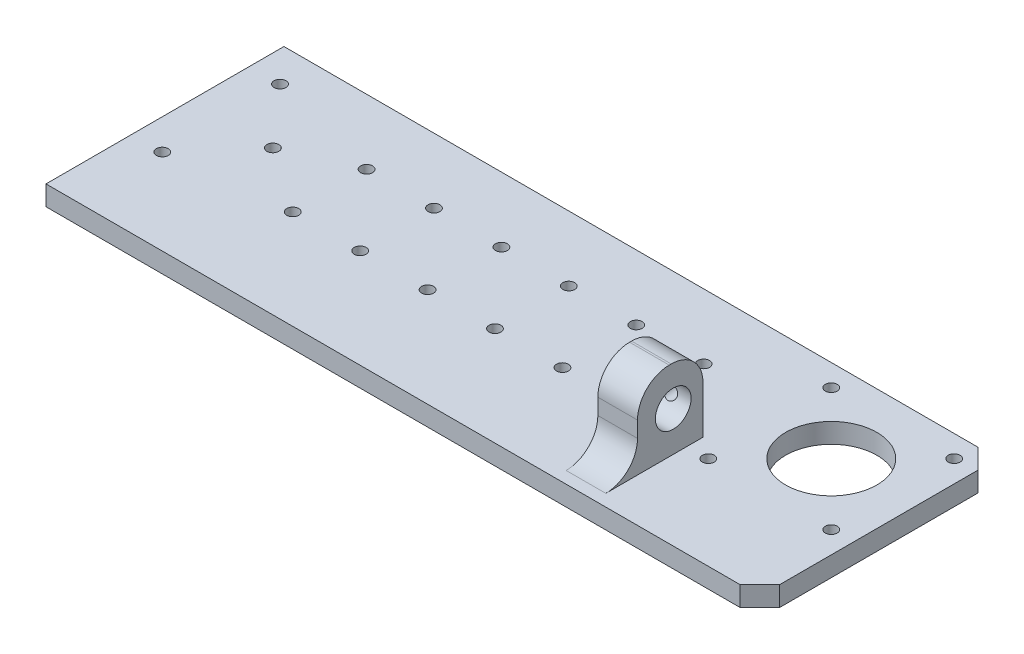
from build123d import *

# Parameters (mm, degrees)
SKETCH_1_W           = 180
SKETCH_1_H           = 60
SKETCH_1_R           = 11
SKETCH_1_R_2         = 1.5
EXTRUDE_3_DEPTH      = 5
SKETCH_2_W           = 10
SKETCH_2_H           = 20
EXTRUDE_4_DEPTH      = 20
SKETCH_4_R           = 4
CUT_EXTRUDE_1_DEPTH  = 20
SKETCH_8_W           = 3
SKETCH_8_H           = 20
CUT_EXTRUDE_4_DEPTH  = 10
SKETCH_10_W          = 14
SKETCH_10_H          = 20
EXTRUDE_5_DEPTH      = 10
SKETCH_9_R           = 4
CUT_EXTRUDE_5_DEPTH  = 10
SKETCH_12_W          = 13.5
SKETCH_12_H          = 20
CUT_EXTRUDE_6_DEPTH  = 10
SKETCH_15_W          = 1
SKETCH_15_H          = 20
CUT_EXTRUDE_7_DEPTH  = 10
FILLET_5_R           = 5
SKETCH_21_W          = 10
SKETCH_21_H          = 18
EXTRUDE_6_DEPTH      = 20
SKETCH_25_W          = 11.311173877
SKETCH_25_H          = 1.5
CUT_EXTRUDE_10_DEPTH = 20
SKETCH_37_W          = 10
SKETCH_37_H          = 20
EXTRUDE_9_DEPTH      = 6
SKETCH_38_W          = 10
SKETCH_38_H          = 20
CUT_EXTRUDE_12_DEPTH = 6
SKETCH_39_R          = 4
CUT_EXTRUDE_13_DEPTH = 144.937604561
FILLET_10_R          = 8
SKETCH_41_R          = 1.5
CUT_EXTRUDE_14_DEPTH = 10
SKETCH_42_R          = 11.5
CUT_EXTRUDE_15_DEPTH = 10
SKETCH_43_R          = 1.691985253
CUT_EXTRUDE_16_DEPTH = 10
SKETCH_44_R          = 4.5
CUT_EXTRUDE_17_DEPTH = 10
CUT_EXTRUDE_18_DEPTH = 10


with BuildPart() as part:
    # 스케치1 → 보스-돌출3 (new body)
    with BuildSketch(Plane(origin=(0, 0, 0), x_dir=(1, 0, 0), z_dir=(0, 1, 0))):
        with Locations((36.632340007, -1.742375967)):
            Rectangle(SKETCH_1_W, SKETCH_1_H)
        with Locations(Location((105.632340007, 7.257624033, 0), (0, 0, 270))):
            Circle(SKETCH_1_R, mode=Mode.SUBTRACT)
        with Locations(Location((90.132340007, 22.757624033, 0), (0, 0, 270))):
            Circle(SKETCH_1_R_2, mode=Mode.SUBTRACT)
        with Locations(Location((121.132340007, 22.757624033, 0), (0, 0, 270))):
            Circle(SKETCH_1_R_2, mode=Mode.SUBTRACT)
        with Locations(Location((90.132340007, -8.242375967, 0), (0, 0, 270))):
            Circle(SKETCH_1_R_2, mode=Mode.SUBTRACT)
        with Locations(Location((121.132340007, -8.242375967, 0), (0, 0, 270))):
            Circle(SKETCH_1_R_2, mode=Mode.SUBTRACT)
        with Locations(Location((-32.617755763, 4.712595626, 0), (0, 0, 270))):
            Circle(SKETCH_1_R_2, mode=Mode.SUBTRACT)
        with Locations(Location((-45.654401225, 19.548720133, 0), (0, 0, 270))):
            Circle(SKETCH_1_R_2, mode=Mode.SUBTRACT)
        with Locations(Location((-45.654401225, -10.123528882, 0), (0, 0, 270))):
            Circle(SKETCH_1_R_2, mode=Mode.SUBTRACT)
    extrude(amount=EXTRUDE_3_DEPTH)

    # 스케치2 → 보스-돌출4 (add)
    with BuildSketch(Plane(origin=(0, 5, 0), x_dir=(1, 0, 0), z_dir=(0, 1, 0))):
        with Locations((79.782459712, 8.257624033)):
            Rectangle(SKETCH_2_W, SKETCH_2_H)
    extrude(amount=EXTRUDE_4_DEPTH)

    # 스케치4 → 컷-돌출1 (cut)
    with BuildSketch(Plane.ZY.offset(-74.782459712)):
        with Locations((-8.257624033, 15)):
            Circle(SKETCH_4_R)
    extrude(amount=-CUT_EXTRUDE_1_DEPTH, mode=Mode.SUBTRACT)

    # 스케치8 → 컷-돌출4 (cut)
    with BuildSketch(Plane(origin=(84.782459712, 0, 0), x_dir=(0, 0, -1), z_dir=(1, 0, 0))):
        with Locations((16.757624033, 15)):
            Rectangle(SKETCH_8_W, SKETCH_8_H)
        with Locations((-0.242375967, 15)):
            Rectangle(SKETCH_8_W, SKETCH_8_H)
    extrude(amount=-CUT_EXTRUDE_4_DEPTH, mode=Mode.SUBTRACT)

    # 스케치10 → 보스-돌출5 (add)
    with BuildSketch(Plane(origin=(84.782459712, 0, 0), x_dir=(0, 0, -1), z_dir=(1, 0, 0))):
        with Locations((-5.242375967, 15)):
            Rectangle(SKETCH_10_W, SKETCH_10_H)
    extrude(amount=-EXTRUDE_5_DEPTH)

    # 스케치9 → 컷-돌출5 (cut)
    with BuildSketch(Plane(origin=(84.782459712, 0, 0), x_dir=(0, 0, -1), z_dir=(1, 0, 0))):
        with Locations((-5.242375967, 15)):
            Circle(SKETCH_9_R)
    extrude(amount=-CUT_EXTRUDE_5_DEPTH, mode=Mode.SUBTRACT)

    # 스케치12 → 컷-돌출6 (cut)
    with BuildSketch(Plane(origin=(84.782459712, 0, 0), x_dir=(0, 0, -1), z_dir=(1, 0, 0))):
        with Locations((8.507624033, 15)):
            Rectangle(SKETCH_12_W, SKETCH_12_H)
    extrude(amount=-CUT_EXTRUDE_6_DEPTH, mode=Mode.SUBTRACT)

    # 스케치15 → 컷-돌출7 (cut)
    with BuildSketch(Plane(origin=(84.782459712, 0, 0), x_dir=(0, 0, -1), z_dir=(1, 0, 0))):
        with Locations((1.257624033, 15)):
            Rectangle(SKETCH_15_W, SKETCH_15_H)
    extrude(amount=-CUT_EXTRUDE_7_DEPTH, mode=Mode.SUBTRACT)

    # 필렛5
    fillet_5_edges = [part.edges().sort_by_distance(p)[0] for p in [
        (79.782459712, 25, -0.757624033),
        (79.782459712, 25, 12.242375967),
    ]]
    fillet(fillet_5_edges, radius=FILLET_5_R)

    # 스케치21 → 보스-돌출6 (add)
    with BuildSketch(Plane(origin=(0, 5, 0), x_dir=(1, 0, 0), z_dir=(0, 1, 0))):
        with Locations((79.782459712, -5.742375967)):
            Rectangle(SKETCH_21_W, SKETCH_21_H)
    extrude(amount=EXTRUDE_6_DEPTH)

    # 스케치25 → 컷-돌출10 (cut)
    with BuildSketch(Plane(origin=(0, 5, 0), x_dir=(1, 0, 0), z_dir=(0, 1, 0))):
        with Locations((79.126872773, 2.507624033)):
            Rectangle(SKETCH_25_W, SKETCH_25_H)
    extrude(amount=CUT_EXTRUDE_10_DEPTH, mode=Mode.SUBTRACT)

    # 스케치37 → 보스-돌출9 (add)
    with BuildSketch(Plane.XY.offset(14.742375967)):
        with Locations((79.782459712, 15)):
            Rectangle(SKETCH_37_W, SKETCH_37_H)
    extrude(amount=EXTRUDE_9_DEPTH)

    # 스케치38 → 컷-돌출12 (cut)
    with BuildSketch(Plane(origin=(0, 0, -1.757624033), x_dir=(-1, 0, 0), z_dir=(0, 0, -1))):
        with Locations((-79.782459712, 15)):
            Rectangle(SKETCH_38_W, SKETCH_38_H)
    extrude(amount=-CUT_EXTRUDE_12_DEPTH, mode=Mode.SUBTRACT)

    # 스케치39 → 컷-돌출13 (cut, through all)
    with BuildSketch(Plane(origin=(84.782459712, 0, 0), x_dir=(0, 0, -1), z_dir=(1, 0, 0))):
        with Locations((-11.742375967, 15)):
            Circle(SKETCH_39_R)
    extrude(amount=-CUT_EXTRUDE_13_DEPTH, mode=Mode.SUBTRACT)

    # 필렛10
    fillet_10_edges = [part.edges().sort_by_distance(p)[0] for p in [
        (79.782459712, 25, 20.742375967),
        (79.782459712, 5, 20.742375967),
        (79.782459712, 25, 4.242375967),
    ]]
    fillet(fillet_10_edges, radius=FILLET_10_R)

    # 스케치41 → 컷-돌출14 (cut)
    with BuildSketch(Plane(origin=(0, 5, 0), x_dir=(1, 0, 0), z_dir=(0, 1, 0))):
        with Locations(Location((-16.145477704, -6.751246634, 0), (0, 0, 270))):
            Circle(SKETCH_41_R)
        with Locations(Location((-16.145477704, 11.864366715, 0), (0, 0, 270))):
            Circle(SKETCH_41_R)
        with Locations(Location((0.854522296, 11.864366715, 0), (0, 0, 270))):
            Circle(SKETCH_41_R)
        with Locations(Location((0.854522296, -6.751246634, 0), (0, 0, 270))):
            Circle(SKETCH_41_R)
        with Locations(Location((17.854522296, 11.864366715, 0), (0, 0, 270))):
            Circle(SKETCH_41_R)
        with Locations(Location((17.854522296, -6.751246634, 0), (0, 0, 270))):
            Circle(SKETCH_41_R)
        with Locations(Location((34.854522296, 11.864366715, 0), (0, 0, 270))):
            Circle(SKETCH_41_R)
        with Locations(Location((34.854522296, -6.751246634, 0), (0, 0, 270))):
            Circle(SKETCH_41_R)
        with Locations(Location((51.854522296, 11.864366715, 0), (0, 0, 270))):
            Circle(SKETCH_41_R)
        with Locations(Location((51.854522296, -6.751246634, 0), (0, 0, 270))):
            Circle(SKETCH_41_R)
        with Locations(Location((68.854522296, 11.864366715, 0), (0, 0, 270))):
            Circle(SKETCH_41_R)
        with Locations(Location((68.854522296, -6.751246634, 0), (0, 0, 270))):
            Circle(SKETCH_41_R)
    extrude(amount=-CUT_EXTRUDE_14_DEPTH, mode=Mode.SUBTRACT)

    # 스케치42 → 컷-돌출15 (cut)
    with BuildSketch(Plane(origin=(0, 5, 0), x_dir=(1, 0, 0), z_dir=(0, 1, 0))):
        with Locations(Location((105.632340007, 7.257624033, 0), (0, 0, 270))):
            Circle(SKETCH_42_R)
    extrude(amount=-CUT_EXTRUDE_15_DEPTH, mode=Mode.SUBTRACT)

    # 스케치43 → 컷-돌출16 (cut)
    with BuildSketch(Plane(origin=(0, 0, 4.242375967), x_dir=(-1, 0, 0), z_dir=(0, 0, -1))):
        with Locations((-79.782459712, 14.121740896)):
            Circle(SKETCH_43_R)
    extrude(amount=-CUT_EXTRUDE_16_DEPTH, mode=Mode.SUBTRACT)

    # 스케치44 → 컷-돌출17 (cut)
    with BuildSketch(Plane.ZY.offset(-74.782459712)):
        with Locations((11.742375967, 15)):
            Circle(SKETCH_44_R)
    extrude(amount=-CUT_EXTRUDE_17_DEPTH, mode=Mode.SUBTRACT)

    # 스케치46 → 컷-돌출18 (cut)
    with BuildSketch(Plane(origin=(0, 5, 0), x_dir=(1, 0, 0), z_dir=(0, 1, 0))):
        Polygon((126.632340007, 28.257624033), (121.632340007, 28.257624033), (126.632340007, 23.257624033), align=None)
        Polygon((126.632340007, -31.742375967), (121.632340007, -31.742375967), (126.632340007, -26.742375967), align=None)
    extrude(amount=-CUT_EXTRUDE_18_DEPTH, mode=Mode.SUBTRACT)


solid = part.part
